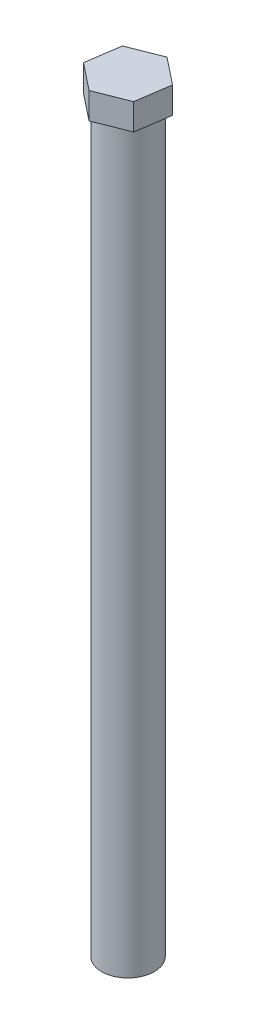
from build123d import *

# Parameters (mm, degrees)
SKETCH1_R           = 2
BOSS_EXTRUDE1_DEPTH = 56
BOSS_EXTRUDE2_DEPTH = 2


with BuildPart() as part:
    # Sketch1 → Boss-Extrude1 (new body)
    with BuildSketch(Plane(origin=(0, 0, 0), x_dir=(1, 0, 0), z_dir=(0, 1, 0))):
        with Locations(Location((0, 0, 0), (0, 0, 270))):
            Circle(SKETCH1_R)
    extrude(amount=BOSS_EXTRUDE1_DEPTH)

    # Sketch2 → Boss-Extrude2 (add)
    with BuildSketch(Plane(origin=(0, 56, 0), x_dir=(1, 0, 0), z_dir=(0, 1, 0))):
        Polygon((2.039992028, -1.615670017), (2.419207293, 0.958849912), (0.379215264, 2.574519928), (-2.039992028, 1.615670017), (-2.419207293, -0.958849912), (-0.379215264, -2.574519928), align=None)
    extrude(amount=BOSS_EXTRUDE2_DEPTH)


solid = part.part
